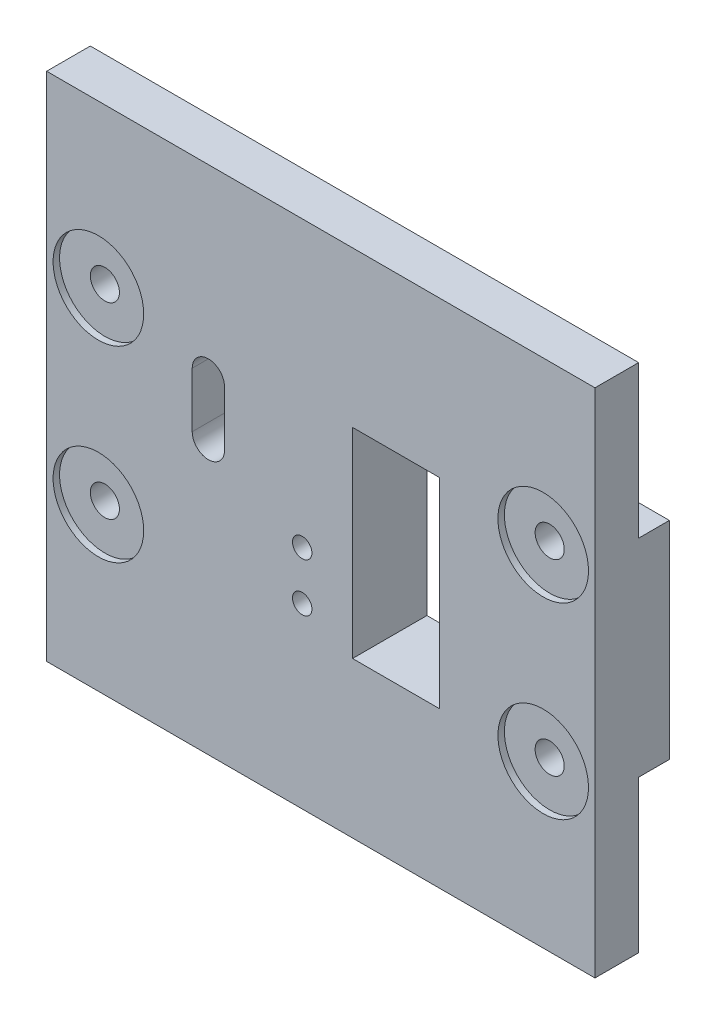
from build123d import *

# Parameters (mm, degrees)
SKETCH2_W                  = 169.5
SKETCH2_H                  = 158
SKETCH2_R                  = 3
SKETCH2_W_2                = 26.88
SKETCH2_H_2                = 61.88
BOSS_EXTRUDE1_DEPTH        = 23
CUT_EXTRUDE1_DEPTH         = 189.415100244
CUT_EXTRUDE1_DEPTH_BACK    = 189.415100244
SKETCH3_W                  = 9.5
SKETCH3_H                  = 47
SKETCH4_R                  = 2
CUT_EXTRUDE2_DEPTH         = 7.5
SKETCH6_R                  = 14
CUT_EXTRUDE4_DEPTH         = 2
M10X1_0_TAPPED_HOLE1_D     = 9
M10X1_0_TAPPED_HOLE1_DEPTH = 10
M10X1_0_TAPPED_HOLE1_TIP   = 2.703872786


with BuildPart() as part:
    # Sketch2 → Boss-Extrude1 (new body)
    with BuildSketch(Plane.XY):
        with Locations((34.75, 0)):
            Rectangle(SKETCH2_W, SKETCH2_H)
        with Locations((29, -9)):
            Circle(SKETCH2_R, mode=Mode.SUBTRACT)
        with Locations((29, -24)):
            Circle(SKETCH2_R, mode=Mode.SUBTRACT)
        with BuildLine():
            Line((-5, 22), (-5, 5))
            ThreePointArc((-5, 5), (0, 0), (5, 5))
            Line((5, 5), (5, 22))
            ThreePointArc((5, 22), (0, 27), (-5, 22))
        make_face(mode=Mode.SUBTRACT)
        with Locations((58, 0)):
            Rectangle(SKETCH2_W_2, SKETCH2_H_2, mode=Mode.SUBTRACT)
    extrude(amount=BOSS_EXTRUDE1_DEPTH)

    # Sketch3 → Cut-Extrude1 (cut, two sides: drawn at the far end of the back side and taken through both)
    with BuildSketch(Plane(origin=(119.5, 0, 0), x_dir=(0, 0, -1), z_dir=(1, 0, 0)).offset(-CUT_EXTRUDE1_DEPTH_BACK)):
        with Locations((-4.75, 55.5)):
            Rectangle(SKETCH3_W, SKETCH3_H)
        with Locations((-4.75, -55.5)):
            Rectangle(SKETCH3_W, SKETCH3_H)
    extrude(amount=CUT_EXTRUDE1_DEPTH + CUT_EXTRUDE1_DEPTH_BACK, mode=Mode.SUBTRACT)

    # Sketch4 → Cut-Extrude2 (cut)
    with BuildSketch(Plane.XY):
        with Locations((74.5, -27)):
            Circle(SKETCH4_R)
        with Locations((74.5, 23)):
            Circle(SKETCH4_R)
        with Locations((27, 18.5)):
            Circle(SKETCH4_R)
        with Locations((27, 8.5)):
            Circle(SKETCH4_R)
    extrude(amount=CUT_EXTRUDE2_DEPTH, mode=Mode.SUBTRACT)

    # Sketch6 → Cut-Extrude4 (cut)
    with BuildSketch(Plane.XY.offset(23)):
        with Locations((103.5, 29)):
            Circle(SKETCH6_R)
        with Locations((103.5, -29)):
            Circle(SKETCH6_R)
        with Locations((-34, 29)):
            Circle(SKETCH6_R)
        with Locations((-34, -29)):
            Circle(SKETCH6_R)
    extrude(amount=-CUT_EXTRUDE4_DEPTH, mode=Mode.SUBTRACT)

    # M10x1.0 Tapped Hole1
    with Locations(Plane(origin=(0, 0, 21), x_dir=(0.9063077870366375, -0.42261826174072625, 0), z_dir=(0, 0, 1))):
        with Locations((-43.07039435, 11.913904925), (-18.558535169, -40.651946723), (81.546926368, 70.023915914), (106.058785549, 17.458064266)):
            Hole(M10X1_0_TAPPED_HOLE1_D / 2, depth=M10X1_0_TAPPED_HOLE1_DEPTH)
            with Locations((0, 0, -(M10X1_0_TAPPED_HOLE1_DEPTH + M10X1_0_TAPPED_HOLE1_TIP / 2))):  # 118° drill point
                Cone(0, M10X1_0_TAPPED_HOLE1_D / 2, M10X1_0_TAPPED_HOLE1_TIP, mode=Mode.SUBTRACT)


solid = part.part
